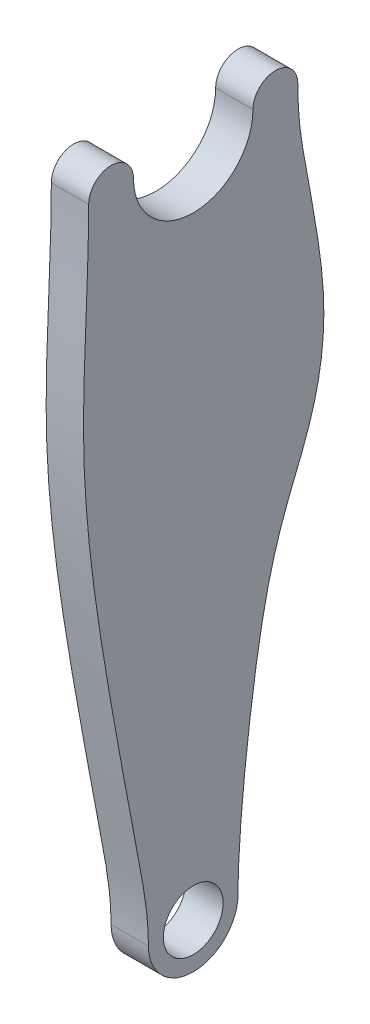
from build123d import *

# Parameters (mm, degrees)
SKETCH1_R           = 8
BOSS_EXTRUDE1_DEPTH = 10


with BuildPart() as part:
    # Sketch1 → Boss-Extrude1 (new body)
    with BuildSketch(Plane(origin=(0, 0, 0), x_dir=(0, 0, -1), z_dir=(1, 0, 0))):
        with BuildLine():
            add(Edge.make_bspline(
                [(28, 0), (28, -7.118899136), (29.32003736, -17.374316549), (39.218709007, -65.18457733), (24.48938936, -94.622041818), (16.83955024, -123.055989281), (12, -165.45650348), (12, -180)],
                knots=[0, 0, 0, 0, 0.084286247, 0.187609719, 0.382215489, 0.5597669, 0.781850651, 0.781850651, 0.781850651, 0.781850651], degree=3))
            ThreePointArc((12, -180), (0, -192), (-12, -180))
            add(Edge.make_bspline(
                [(-28, 0), (-28, -19.841479689), (-31.491847071, -55.945068065), (-24.097890925, -109.086480388), (-16.36971111, -149.426112932), (-12, -172.544928322), (-12, -180)],
                knots=[0, 0, 0, 0, 0.318521568, 0.610749871, 0.878130317, 1, 1, 1, 1], degree=3))
            ThreePointArc((-28, 0), (-22, 6), (-16, 0))
            ThreePointArc((-16, 0), (0, -16), (16, 0))
            ThreePointArc((16, 0), (22, 6), (28, 0))
        make_face()
        with Locations((0, -180)):
            Circle(SKETCH1_R, mode=Mode.SUBTRACT)
    extrude(amount=BOSS_EXTRUDE1_DEPTH)


solid = part.part
